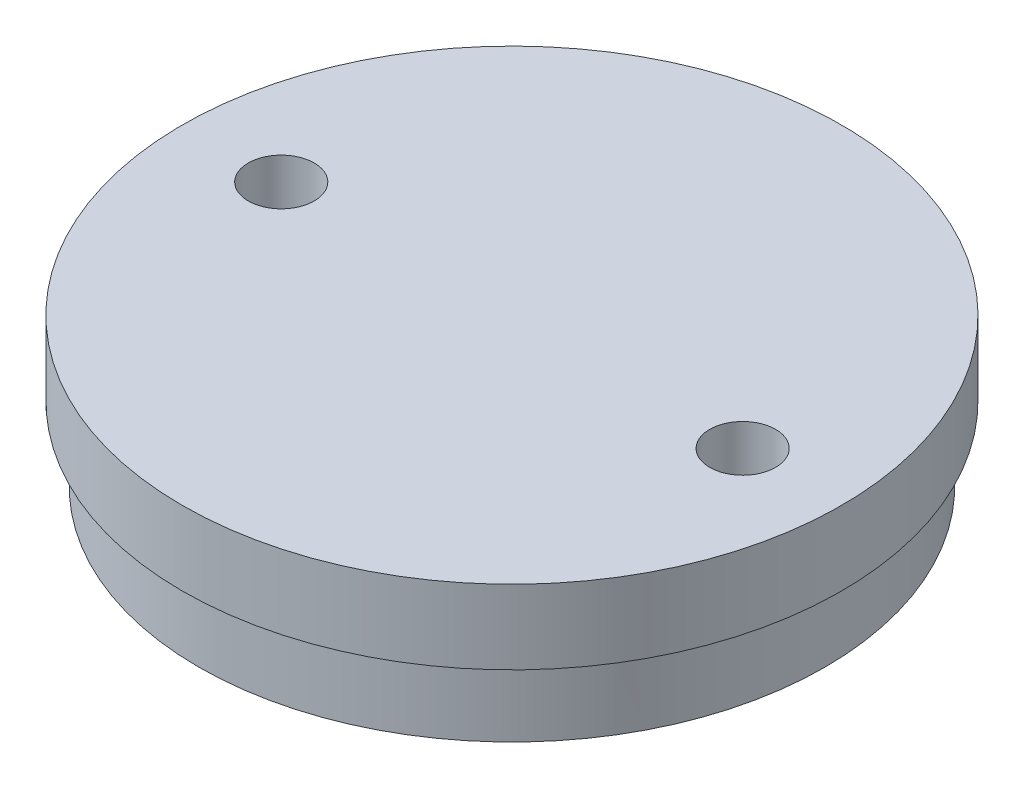
from build123d import *

# Parameters (mm, degrees)
SKETCH1_R             = 40
BOSS_EXTRUDE1_DEPTH   = 9
SKETCH2_R             = 38
SKETCH2_R_2           = 33
BOSS_EXTRUDE2_DEPTH   = 9
F_8_0MM_DOWEL_HOLE1_D = 8


with BuildPart() as part:
    # Sketch1 → Boss-Extrude1 (new body)
    with BuildSketch(Plane(origin=(0, 0, 0), x_dir=(1, 0, 0), z_dir=(0, 1, 0))):
        with Locations(Location((0, 0, 0), (0, 0, 270))):
            Circle(SKETCH1_R)
    extrude(amount=BOSS_EXTRUDE1_DEPTH)

    # Sketch2 → Boss-Extrude2 (add)
    with BuildSketch(Plane.XZ):
        with Locations(Location((0, 0, 0), (0, 0, 90))):
            Circle(SKETCH2_R)
        with Locations(Location((0, 0, 0), (0, 0, 270))):
            Circle(SKETCH2_R_2, mode=Mode.SUBTRACT)
    extrude(amount=BOSS_EXTRUDE2_DEPTH)

    # Ø8.0mm Dowel Hole1 (through all)
    with Locations(Plane(origin=(0, 0, 0), x_dir=(-1, 0, 0), z_dir=(0, -1, 0))):
        with Locations((-28, 0), (28, 0)):
            Hole(F_8_0MM_DOWEL_HOLE1_D / 2)


solid = part.part
